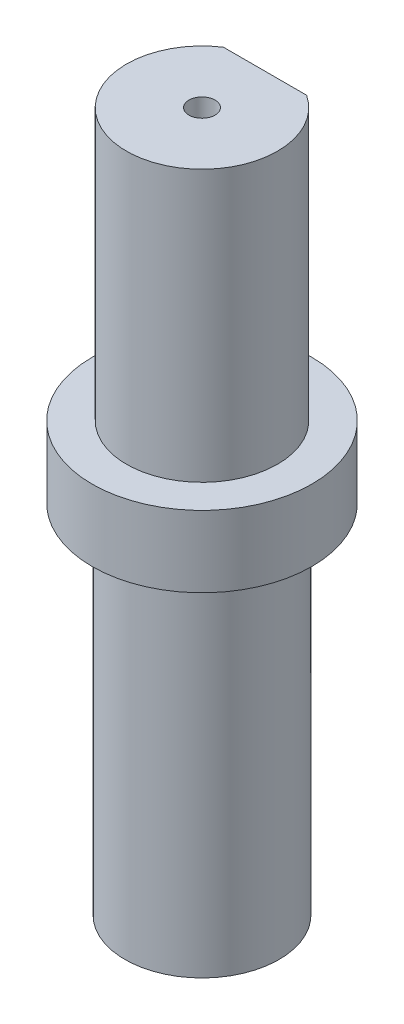
from build123d import *

# Parameters (mm, degrees)
PACKAGING_START                     = -2.65
SKETCH2_W                           = 8
SKETCH2_H                           = 11.4
PACKAGING_FLAT_AT_Z_MINUS2P65_DEPTH = 20


with BuildPart() as part:
    # Sketch1 → Revolve1 (revolve)
    with BuildSketch(Plane.XY, mode=Mode.PRIVATE) as revolve1_sk:
        Polygon((2.665, -18), (2.665, -5), (0.55, -5), (0.55, 11.4), (3.175, 11.4), (3.175, 0), (4.619, 0), (4.619, -3), (3.24, -3), (3.24, -18), align=None)
    revolve(revolve1_sk.sketch.rotate(Axis((0, -200, 0), (0, 1, 0)), 90), axis=Axis((0, -200, 0), (0, 1, 0)))

    # Sketch2 → Packaging flat at Z minus2p65 (cut)
    with BuildSketch(Plane.XY.offset(PACKAGING_START)):
        with Locations((0, 5.7)):
            Rectangle(SKETCH2_W, SKETCH2_H)
    extrude(amount=-PACKAGING_FLAT_AT_Z_MINUS2P65_DEPTH, mode=Mode.SUBTRACT)


solid = part.part
